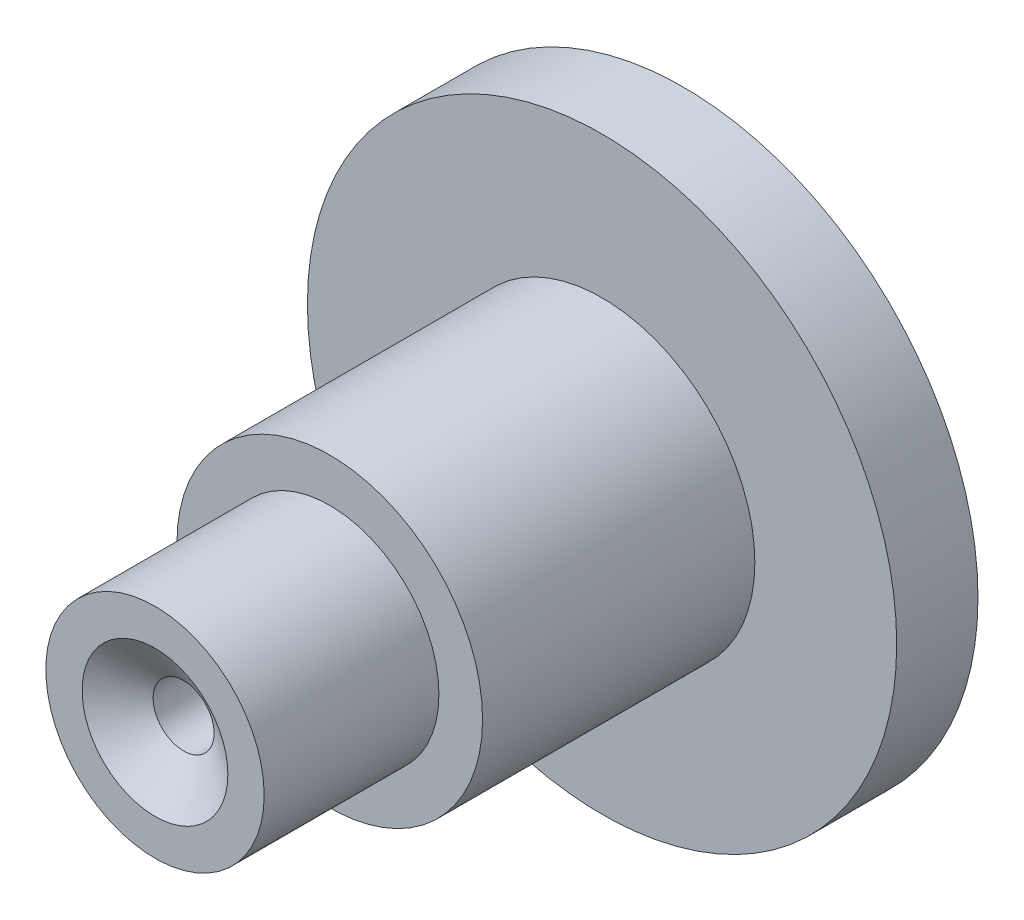
from build123d import *


with BuildPart() as part:
    # Sketch1 → Revolve1 (revolve)
    with BuildSketch(Plane(origin=(0, 0, 0), x_dir=(0, 0, -1), z_dir=(1, 0, 0)), mode=Mode.PRIVATE) as revolve1_sk:
        Polygon((0, 0), (0, 46.0375), (-12.7, 46.0375), (-12.7, 23.876), (-55.245, 23.876), (-55.245, 17.059549957), (-82.55, 17.059549957), (-82.55, 11.385820753), (-78.077653169, 4.7625), (-57.15, 4.7625), (-57.15, 0), align=None)
    revolve(revolve1_sk.sketch.rotate(Axis((0, 0, 57.15), (0, 0, -1)), 90), axis=Axis((0, 0, 57.15), (0, 0, -1)))


solid = part.part
